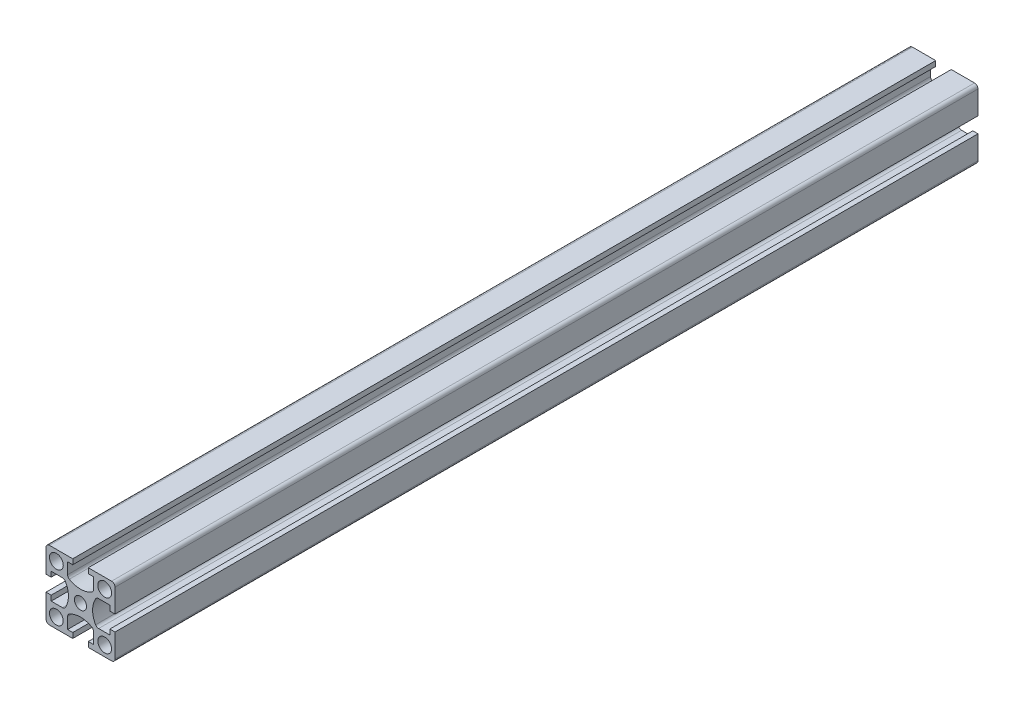
from build123d import *

# Parameters (mm, degrees)
SKETCH1_R           = 4
SKETCH1_R_2         = 3.5
BOSS_EXTRUDE1_DEPTH = 500


with BuildPart() as part:
    # Sketch1 → Boss-Extrude1 (new body)
    with BuildSketch(Plane.XY):
        with BuildLine():
            Line((-20, 18), (-20, 4.5))
            Line((-20, 4.5), (-17, 4.5))
            Line((-17, 4.5), (-17, 7.5))
            Line((-17, 7.5), (-10.473720558, 7.5))
            ThreePointArc((-10.473720558, 7.5), (-9.473720558, 7.232050808), (-8.741669751, 6.5))
            ThreePointArc((-8.741669751, 6.5), (-7, 0), (-8.741669751, -6.5))
            ThreePointArc((-8.741669751, -6.5), (-9.473720558, -7.232050808), (-10.473720558, -7.5))
            Line((-10.473720558, -7.5), (-17, -7.5))
            Line((-17, -7.5), (-17, -4.5))
            Line((-17, -4.5), (-20, -4.5))
            Line((-20, -4.5), (-20, -18))
            ThreePointArc((-20, -18), (-19.414213562, -19.414213562), (-18, -20))
            Line((-18, -20), (-4.5, -20))
            Line((-4.5, -20), (-4.5, -17))
            Line((-4.5, -17), (-7.5, -17))
            Line((-7.5, -17), (-7.5, -10.473720558))
            ThreePointArc((-7.5, -10.473720558), (-7.232050808, -9.473720558), (-6.5, -8.741669751))
            ThreePointArc((-6.5, -8.741669751), (0, -7), (6.5, -8.741669751))
            ThreePointArc((6.5, -8.741669751), (7.232050808, -9.473720558), (7.5, -10.473720558))
            Line((7.5, -10.473720558), (7.5, -17))
            Line((7.5, -17), (4.5, -17))
            Line((4.5, -17), (4.5, -20))
            Line((4.5, -20), (18, -20))
            ThreePointArc((18, -20), (19.414213562, -19.414213562), (20, -18))
            Line((20, -18), (20, -4.5))
            Line((20, -4.5), (17, -4.5))
            Line((17, -4.5), (17, -7.5))
            Line((17, -7.5), (10.473720558, -7.5))
            ThreePointArc((10.473720558, -7.5), (9.473720558, -7.232050808), (8.741669751, -6.5))
            ThreePointArc((8.741669751, -6.5), (7, 0), (8.741669751, 6.5))
            ThreePointArc((8.741669751, 6.5), (9.473720558, 7.232050808), (10.473720558, 7.5))
            Line((10.473720558, 7.5), (17, 7.5))
            Line((17, 7.5), (17, 4.5))
            Line((17, 4.5), (20, 4.5))
            Line((20, 4.5), (20, 18))
            ThreePointArc((20, 18), (19.414213562, 19.414213562), (18, 20))
            Line((18, 20), (4.5, 20))
            Line((4.5, 20), (4.5, 17))
            Line((4.5, 17), (7.5, 17))
            Line((7.5, 17), (7.5, 10.473720558))
            ThreePointArc((7.5, 10.473720558), (7.232050808, 9.473720558), (6.5, 8.741669751))
            ThreePointArc((6.5, 8.741669751), (0, 7), (-6.5, 8.741669751))
            ThreePointArc((-6.5, 8.741669751), (-7.232050808, 9.473720558), (-7.5, 10.473720558))
            Line((-7.5, 10.473720558), (-7.5, 17))
            Line((-7.5, 17), (-4.5, 17))
            Line((-4.5, 17), (-4.5, 20))
            Line((-4.5, 20), (-18, 20))
            ThreePointArc((-18, 20), (-19.414213562, 19.414213562), (-20, 18))
        make_face()
        with Locations((-14, -14)):
            Circle(SKETCH1_R, mode=Mode.SUBTRACT)
        with Locations((14, -14)):
            Circle(SKETCH1_R, mode=Mode.SUBTRACT)
        with Locations((14, 14)):
            Circle(SKETCH1_R, mode=Mode.SUBTRACT)
        Circle(SKETCH1_R_2, mode=Mode.SUBTRACT)
        with Locations((-14, 14)):
            Circle(SKETCH1_R, mode=Mode.SUBTRACT)
    extrude(amount=BOSS_EXTRUDE1_DEPTH)


solid = part.part
